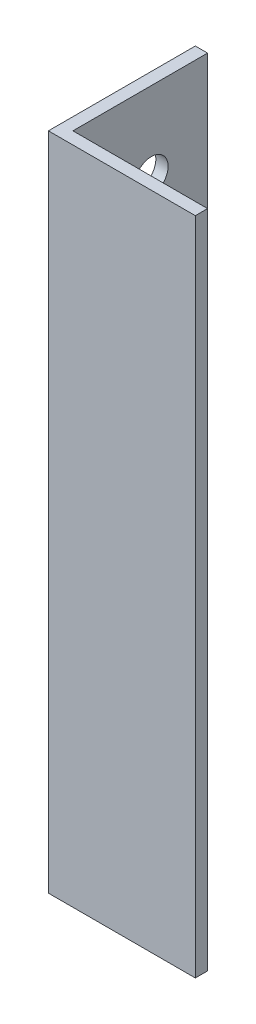
from build123d import *

# Parameters (mm, degrees)
BOSS_EXTRUDE1_DEPTH = 85.598
SKETCH2_R           = 2.1828125
CUT_EXTRUDE1_DEPTH  = 90.737520603


with BuildPart() as part:
    # Sketch1 → Boss-Extrude1 (new body)
    with BuildSketch(Plane(origin=(0, 0, 0), x_dir=(1, 0, 0), z_dir=(0, 1, 0))):
        Polygon((0, 0), (0, 19.05), (1.5875, 19.05), (1.5875, 1.5875), (19.05, 1.5875), (19.05, 0), align=None)
    extrude(amount=BOSS_EXTRUDE1_DEPTH)

    # Sketch2 → Cut-Extrude1 (cut, through all)
    with BuildSketch(Plane.ZY):
        with Locations((-11.7475, 75.438)):
            Circle(SKETCH2_R)
        with Locations((-11.7475, 10.16)):
            Circle(SKETCH2_R)
    extrude(amount=-CUT_EXTRUDE1_DEPTH, mode=Mode.SUBTRACT)


solid = part.part
